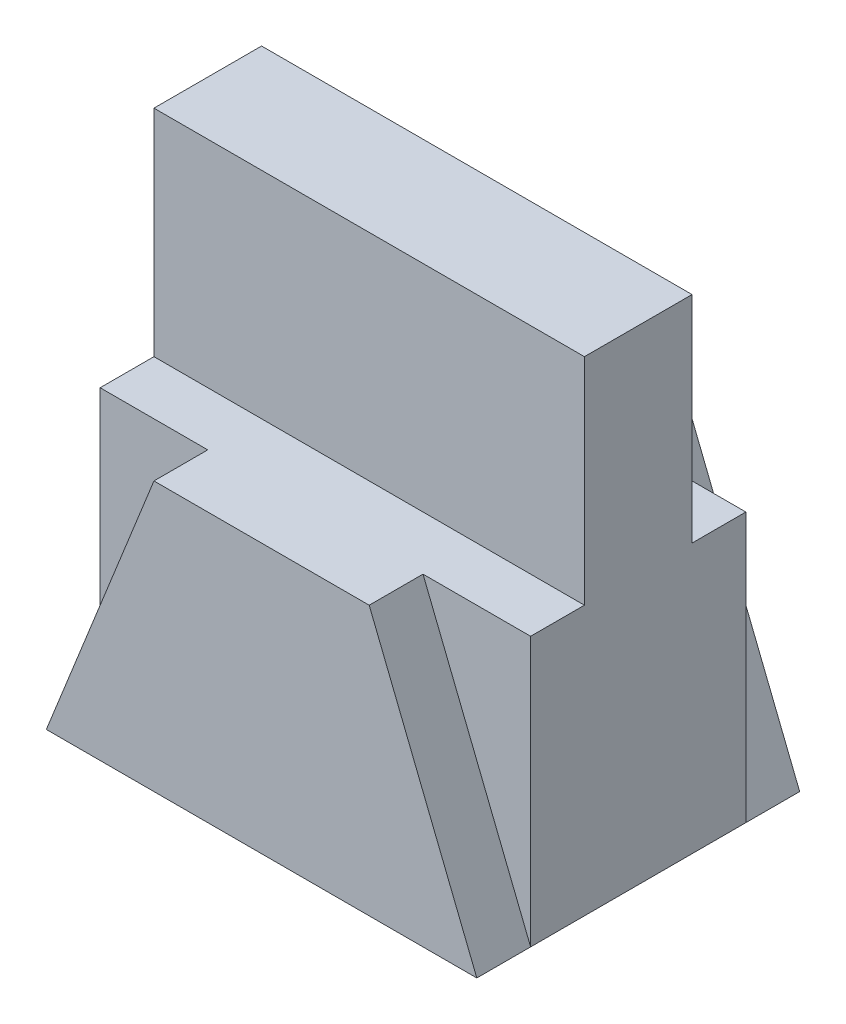
from build123d import *

# Parameters (mm, degrees)
SALIENTE_EXTRUIR1_DEPTH = 20
CORTAR_EXTRUIR1_DEPTH   = 5


with BuildPart() as part:
    # Croquis1 → Saliente-Extruir1 (new, symmetric)
    with BuildSketch(Plane(origin=(0, 0, 0), x_dir=(0, 0, -1), z_dir=(1, 0, 0))):
        Polygon((-15, 0), (15, 0), (15, 25), (5, 25), (5, 45), (-5, 45), (-5, 25), (-15, 25), align=None)
    extrude(amount=SALIENTE_EXTRUIR1_DEPTH, both=True)

    # Croquis3 → Cortar-Extruir1 (cut)
    with BuildSketch(Plane.XY.offset(15)):
        Polygon((-20, 25), (-10, 25), (-20, 0), align=None)
        Polygon((10, 25), (20, 25), (20, 0), align=None)
    cortar_extruir1 = extrude(amount=-CORTAR_EXTRUIR1_DEPTH, mode=Mode.SUBTRACT)

    # Simetría1: Cortar-Extruir1 across plane
    add(cortar_extruir1.mirror(Plane.XY), mode=Mode.SUBTRACT)


solid = part.part
